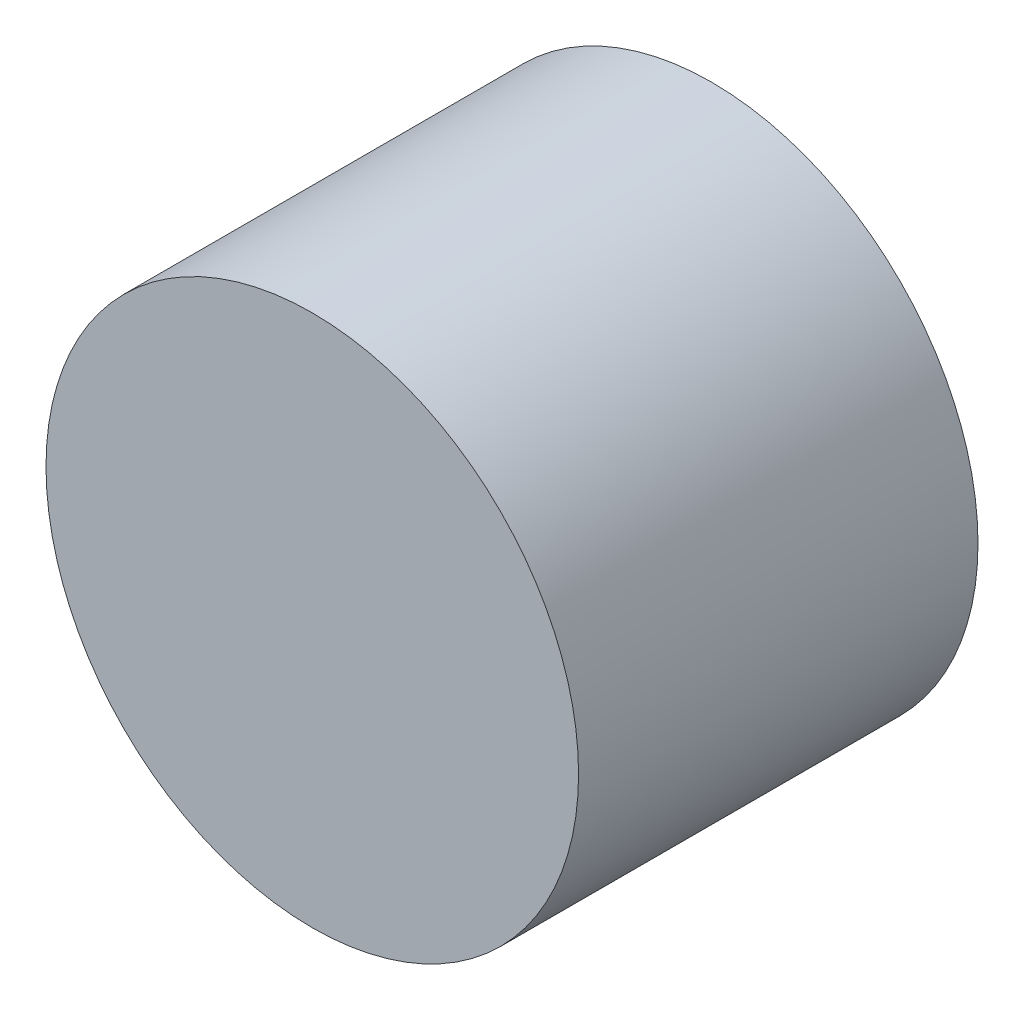
from build123d import *

# Parameters (mm, degrees)
ESQUISSE1_R        = 4
BOSS_EXTRU_1_DEPTH = 6


with BuildPart() as part:
    # Esquisse1 → Boss.-Extru.1 (new body)
    with BuildSketch(Plane.XY):
        Circle(ESQUISSE1_R)
    extrude(amount=BOSS_EXTRU_1_DEPTH)


solid = part.part
